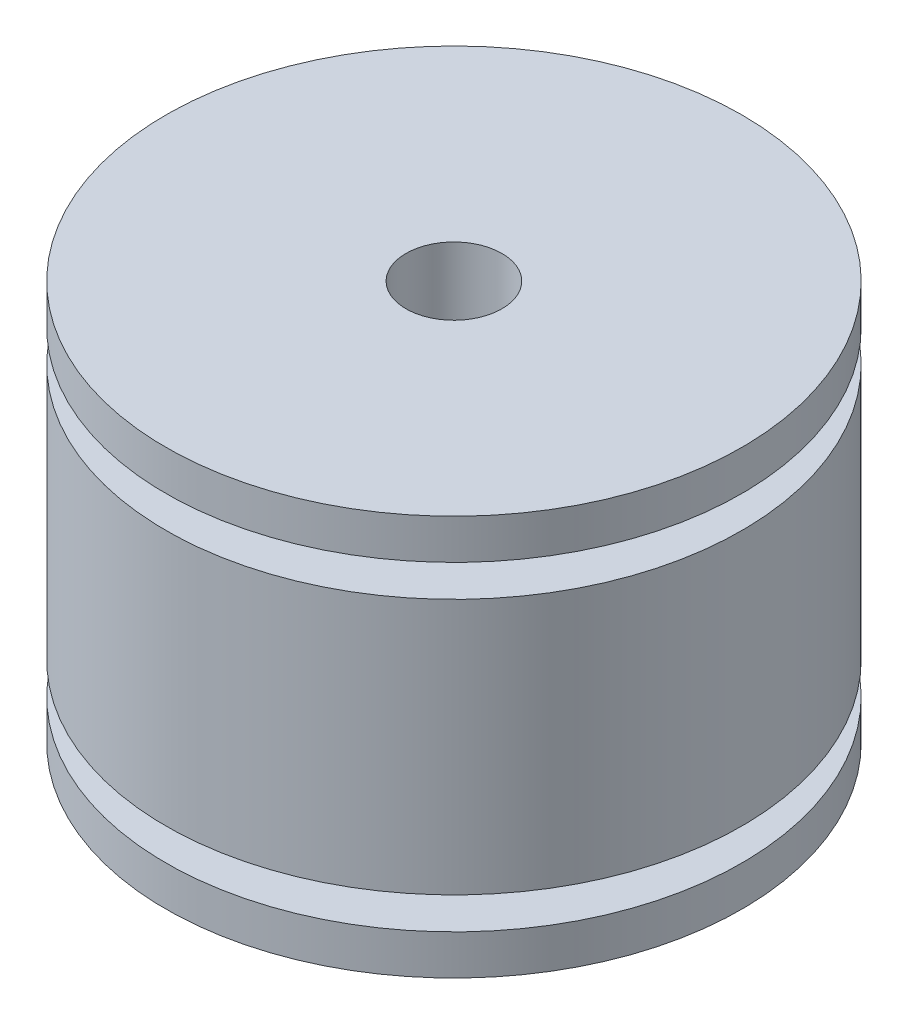
from build123d import *

# Parameters (mm, degrees)
SKETCH2_R          = 1.65
CUT_EXTRUDE1_DEPTH = 36.67912555


with BuildPart() as part:
    # Sketch1 → Revolve1 (revolve)
    with BuildSketch(Plane.XY, mode=Mode.PRIVATE) as revolve1_sk:
        Polygon((10, 0), (18, 0), (18, 2.5), (15, 2.5), (15, 4.5), (18, 4.5), (18, 20.5), (15, 20.5), (15, 22.5), (18, 22.5), (18, 25), (3, 25), (3, 0), align=None)
    revolve(revolve1_sk.sketch.rotate(Axis((0, 0, 0), (0, 1, 0)), 90), axis=Axis((0, 0, 0), (0, 1, 0)))

    # Sketch2 → Cut-Extrude1 (cut, through all)
    with BuildSketch(Plane.XY):
        with Locations(Location((0, 12.5, 0), (0, 0, 90))):
            Circle(SKETCH2_R)
    extrude(amount=-CUT_EXTRUDE1_DEPTH, mode=Mode.SUBTRACT)


solid = part.part
